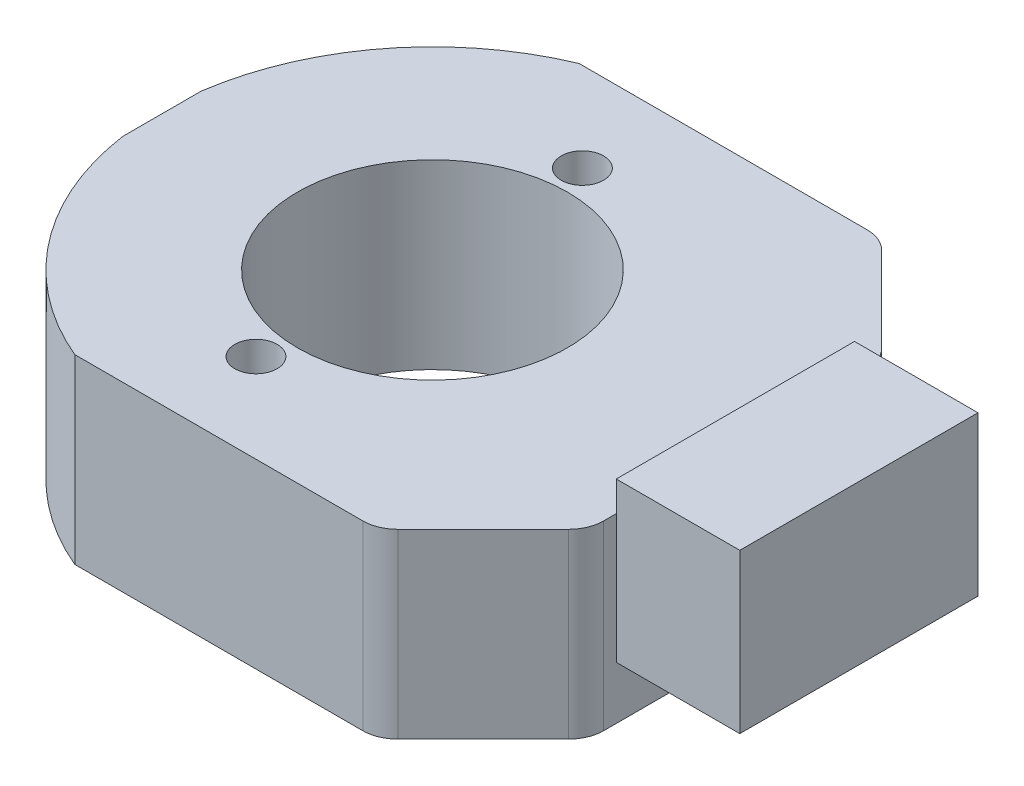
from build123d import *

# Parameters (mm, degrees)
SKETCH_1_R          = 7.65
EXTRUDE_1_DEPTH     = 10.3
SKETCH_2_R          = 1.2
CUT_EXTRUDE_1_DEPTH = 10.5
CHAMFER_1_SIZE      = 6
FILLET_1_R          = 2
EXTRUDE_START       = 3
SKETCH_4_W          = 7
SKETCH_4_H          = 13.5
EXTRUDE_2_DEPTH     = 9


with BuildPart() as part:
    # ｽｹｯﾁ1 → ﾎﾞｽ - 押し出し1 (new body)
    with BuildSketch(Plane(origin=(0, 0, 0), x_dir=(1, 0, 0), z_dir=(0, 1, 0))):
        with BuildLine():
            Line((17.17, 14.29), (-5.977959518, 14.29))
            ThreePointArc((-5.977959518, 14.29), (-12.244374402, 9.48764436), (-15.33, 2.220630541))
            Line((-15.33, 2.220630541), (-15.33, -2.220630541))
            ThreePointArc((-15.33, -2.220630541), (-12.244374402, -9.48764436), (-5.977959518, -14.29))
            Line((-5.977959518, -14.29), (17.17, -14.29))
            Line((17.17, -14.29), (17.17, 14.29))
        make_face()
        with Locations(Location((0, 0, 0), (0, 0, 90))):
            Circle(SKETCH_1_R, mode=Mode.SUBTRACT)
    extrude(amount=EXTRUDE_1_DEPTH)

    # ｽｹｯﾁ2 → ｶｯﾄ - 押し出し1 (cut)
    with BuildSketch(Plane.XZ):
        with Locations(Location((-0.75, 9.25, 0), (0, 0, 270))):
            Circle(SKETCH_2_R)
        with Locations(Location((-0.75, -9.25, 0), (0, 0, 270))):
            Circle(SKETCH_2_R)
    extrude(amount=-CUT_EXTRUDE_1_DEPTH, mode=Mode.SUBTRACT)

    # 面取り1
    chamfer_1_edges = [part.edges().sort_by_distance(p)[0] for p in [
        (17.17, 5.15, 14.29),
        (17.17, 5.15, -14.29),
    ]]
    chamfer(chamfer_1_edges, length=CHAMFER_1_SIZE)

    # ﾌｨﾚｯﾄ1
    fillet_1_edges = [part.edges().sort_by_distance(p)[0] for p in [
        (17.17, 5.15, 8.29),
        (17.17, 5.15, -8.29),
        (11.17, 5.15, 14.29),
        (11.17, 5.15, -14.29),
    ]]
    fillet(fillet_1_edges, radius=FILLET_1_R)

    # ｽｹｯﾁ4 → ﾎﾞｽ - 押し出し2 (add)
    with BuildSketch(Plane(origin=(0, 0, 0), x_dir=(1, 0, 0), z_dir=(0, 1, 0)).offset(EXTRUDE_START)):
        with Locations((20.67, 0)):
            Rectangle(SKETCH_4_W, SKETCH_4_H)
    extrude(amount=EXTRUDE_2_DEPTH)


solid = part.part
